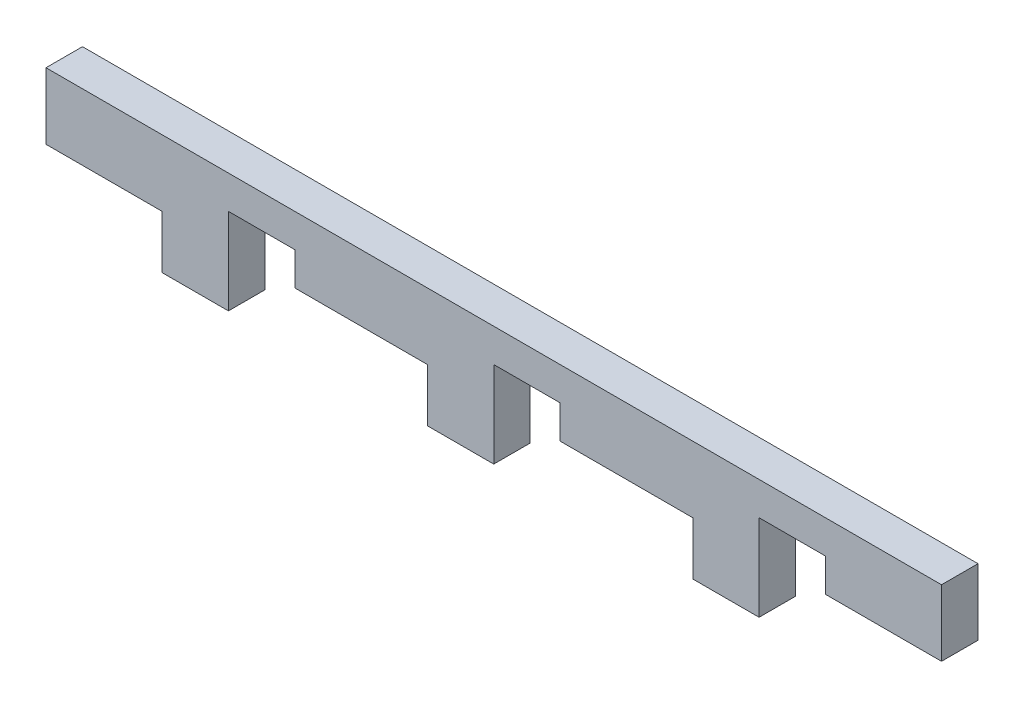
from build123d import *

# Parameters (mm, degrees)
EXTRUDE_1_DEPTH = 5.5


with BuildPart() as part:
    # 草图1 → 凸台-拉伸1 (new body)
    with BuildSketch(Plane.XY):
        Polygon((-67.5, -10), (-67.5, 0), (67.5, 0), (67.5, -10), (50, -10), (50, -5), (40, -5), (40, -18), (30, -18), (30, -10), (10, -10), (10, -5), (0, -5), (0, -18), (-10, -18), (-10, -10), (-30, -10), (-30, -5), (-40, -5), (-40, -18), (-50, -18), (-50, -10), align=None)
    extrude(amount=EXTRUDE_1_DEPTH)


solid = part.part
